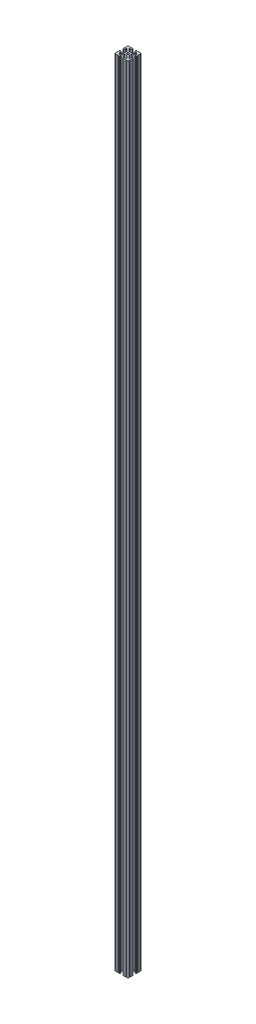
from build123d import *

# Parameters (mm, degrees)
SCHIZZO1_R                   = 2.62
ESTRUSIONE_ESTRUSIONE1_DEPTH = 1780


with BuildPart() as part:
    # Schizzo1 → Estrusione-Estrusione1 (new body)
    with BuildSketch(Plane(origin=(0, 152.4, 0), x_dir=(1, 0, 0), z_dir=(0, 1, 0))):
        with BuildLine():
            Line((130, 32), (130, 33.687990441))
            ThreePointArc((130, 33.687990441), (129.687990441, 34), (130, 34.312009559))
            Line((130, 34.312009559), (130, 37.687990441))
            ThreePointArc((130, 37.687990441), (129.687990441, 38), (130, 38.312009559))
            Line((130, 38.312009559), (130, 40.4))
            ThreePointArc((130, 40.4), (129.589949494, 41.389949494), (128.6, 41.8))
            Line((128.6, 41.8), (128.2, 41.8))
            ThreePointArc((128.2, 41.8), (127.210050506, 41.389949494), (126.8, 40.4))
            Line((126.8, 40.4), (126.8, 37.39411255))
            ThreePointArc((126.8, 37.39411255), (126.306146746, 36.655008924), (125.434314575, 36.828427125))
            Line((125.434314575, 36.828427125), (120.905786438, 41.356955262))
            ThreePointArc((120.905786438, 41.356955262), (120.472240935, 42.00580196), (120.32, 42.771168825))
            Line((120.32, 42.771168825), (120.32, 47.228831175))
            ThreePointArc((120.32, 47.228831175), (120.472240935, 47.99419804), (120.905786438, 48.643044738))
            Line((120.905786438, 48.643044738), (125.434314575, 53.171572875))
            ThreePointArc((125.434314575, 53.171572875), (126.306146746, 53.344991076), (126.8, 52.60588745))
            Line((126.8, 52.60588745), (126.8, 49.6))
            ThreePointArc((126.8, 49.6), (127.210050506, 48.610050506), (128.2, 48.2))
            Line((128.2, 48.2), (128.6, 48.2))
            ThreePointArc((128.6, 48.2), (129.589949494, 48.610050506), (130, 49.6))
            Line((130, 49.6), (130, 51.687990441))
            ThreePointArc((130, 51.687990441), (129.687990441, 52), (130, 52.312009559))
            Line((130, 52.312009559), (130, 55.687990441))
            ThreePointArc((130, 55.687990441), (129.687990441, 56), (130, 56.312009559))
            Line((130, 56.312009559), (130, 58))
            ThreePointArc((130, 58), (129.414213562, 59.414213562), (128, 60))
            Line((128, 60), (126.312009559, 60))
            ThreePointArc((126.312009559, 60), (126, 59.687990441), (125.687990441, 60))
            Line((125.687990441, 60), (122.312009559, 60))
            ThreePointArc((122.312009559, 60), (122, 59.687990441), (121.687990441, 60))
            Line((121.687990441, 60), (119.6, 60))
            ThreePointArc((119.6, 60), (118.610050506, 59.589949494), (118.2, 58.6))
            Line((118.2, 58.6), (118.2, 58.2))
            ThreePointArc((118.2, 58.2), (118.610050506, 57.210050506), (119.6, 56.8))
            Line((119.6, 56.8), (122.60588745, 56.8))
            ThreePointArc((122.60588745, 56.8), (123.344991076, 56.306146746), (123.171572875, 55.434314575))
            Line((123.171572875, 55.434314575), (118.643044738, 50.905786438))
            ThreePointArc((118.643044738, 50.905786438), (117.99419804, 50.472240935), (117.228831175, 50.32))
            Line((117.228831175, 50.32), (112.771168825, 50.32))
            ThreePointArc((112.771168825, 50.32), (112.00580196, 50.472240935), (111.356955262, 50.905786438))
            Line((111.356955262, 50.905786438), (106.828427125, 55.434314575))
            ThreePointArc((106.828427125, 55.434314575), (106.655008924, 56.306146746), (107.39411255, 56.8))
            Line((107.39411255, 56.8), (110.4, 56.8))
            ThreePointArc((110.4, 56.8), (111.389949494, 57.210050506), (111.8, 58.2))
            Line((111.8, 58.2), (111.8, 58.6))
            ThreePointArc((111.8, 58.6), (111.389949494, 59.589949494), (110.4, 60))
            Line((110.4, 60), (108.312009559, 60))
            ThreePointArc((108.312009559, 60), (108, 59.687990441), (107.687990441, 60))
            Line((107.687990441, 60), (104.312009559, 60))
            ThreePointArc((104.312009559, 60), (104, 59.687990441), (103.687990441, 60))
            Line((103.687990441, 60), (102, 60))
            ThreePointArc((102, 60), (100.585786438, 59.414213562), (100, 58))
            Line((100, 58), (100, 56.312009559))
            ThreePointArc((100, 56.312009559), (100.312009559, 56), (100, 55.687990441))
            Line((100, 55.687990441), (100, 52.312009559))
            ThreePointArc((100, 52.312009559), (100.312009559, 52), (100, 51.687990441))
            Line((100, 51.687990441), (100, 49.6))
            ThreePointArc((100, 49.6), (100.410050506, 48.610050506), (101.4, 48.2))
            Line((101.4, 48.2), (101.8, 48.2))
            ThreePointArc((101.8, 48.2), (102.789949494, 48.610050506), (103.2, 49.6))
            Line((103.2, 49.6), (103.2, 52.60588745))
            ThreePointArc((103.2, 52.60588745), (103.693853254, 53.344991076), (104.565685425, 53.171572875))
            Line((104.565685425, 53.171572875), (109.094213562, 48.643044738))
            ThreePointArc((109.094213562, 48.643044738), (109.527759065, 47.99419804), (109.68, 47.228831175))
            Line((109.68, 47.228831175), (109.68, 42.771168825))
            ThreePointArc((109.68, 42.771168825), (109.527759065, 42.00580196), (109.094213562, 41.356955262))
            Line((109.094213562, 41.356955262), (104.565685425, 36.828427125))
            ThreePointArc((104.565685425, 36.828427125), (103.693853254, 36.655008924), (103.2, 37.39411255))
            Line((103.2, 37.39411255), (103.2, 40.4))
            ThreePointArc((103.2, 40.4), (102.789949494, 41.389949494), (101.8, 41.8))
            Line((101.8, 41.8), (101.4, 41.8))
            ThreePointArc((101.4, 41.8), (100.410050506, 41.389949494), (100, 40.4))
            Line((100, 40.4), (100, 38.312009559))
            ThreePointArc((100, 38.312009559), (100.312009559, 38), (100, 37.687990441))
            Line((100, 37.687990441), (100, 34.312009559))
            ThreePointArc((100, 34.312009559), (100.312009559, 34), (100, 33.687990441))
            Line((100, 33.687990441), (100, 32))
            ThreePointArc((100, 32), (100.585786438, 30.585786438), (102, 30))
            Line((102, 30), (103.687990441, 30))
            ThreePointArc((103.687990441, 30), (104, 30.312009559), (104.312009559, 30))
            Line((104.312009559, 30), (107.687990441, 30))
            ThreePointArc((107.687990441, 30), (108, 30.312009559), (108.312009559, 30))
            Line((108.312009559, 30), (110.4, 30))
            ThreePointArc((110.4, 30), (111.389949494, 30.410050506), (111.8, 31.4))
            Line((111.8, 31.4), (111.8, 31.8))
            ThreePointArc((111.8, 31.8), (111.389949494, 32.789949494), (110.4, 33.2))
            Line((110.4, 33.2), (107.39411255, 33.2))
            ThreePointArc((107.39411255, 33.2), (106.655008924, 33.693853254), (106.828427125, 34.565685425))
            Line((106.828427125, 34.565685425), (111.356955262, 39.094213562))
            ThreePointArc((111.356955262, 39.094213562), (112.00580196, 39.527759065), (112.771168825, 39.68))
            Line((112.771168825, 39.68), (117.228831175, 39.68))
            ThreePointArc((117.228831175, 39.68), (117.99419804, 39.527759065), (118.643044738, 39.094213562))
            Line((118.643044738, 39.094213562), (123.171572875, 34.565685425))
            ThreePointArc((123.171572875, 34.565685425), (123.344991076, 33.693853254), (122.60588745, 33.2))
            Line((122.60588745, 33.2), (119.6, 33.2))
            ThreePointArc((119.6, 33.2), (118.610050506, 32.789949494), (118.2, 31.8))
            Line((118.2, 31.8), (118.2, 31.4))
            ThreePointArc((118.2, 31.4), (118.610050506, 30.410050506), (119.6, 30))
            Line((119.6, 30), (121.687990441, 30))
            ThreePointArc((121.687990441, 30), (122, 30.312009559), (122.312009559, 30))
            Line((122.312009559, 30), (125.687990441, 30))
            ThreePointArc((125.687990441, 30), (126, 30.312009559), (126.312009559, 30))
            Line((126.312009559, 30), (128, 30))
            ThreePointArc((128, 30), (129.414213562, 30.585786438), (130, 32))
        make_face()
        with Locations(Location((115, 45, 0), (0, 0, 90))):
            Circle(SCHIZZO1_R, mode=Mode.SUBTRACT)
    extrude(amount=-ESTRUSIONE_ESTRUSIONE1_DEPTH)


solid = part.part
